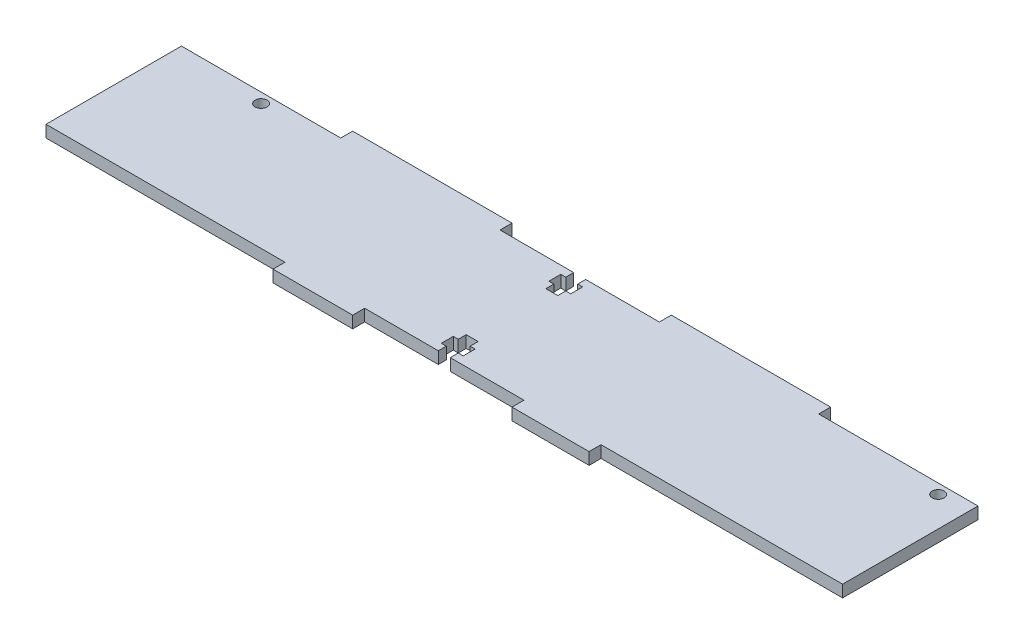
from build123d import *

# Parameters (mm, degrees)
SKETCH1_W           = 200
SKETCH1_H           = 40
BOSS_EXTRUDE1_DEPTH = 3
SKETCH3_W           = 60
SKETCH3_H           = 3
SKETCH3_W_2         = 60.649381746
CUT_EXTRUDE1_DEPTH  = 3
SKETCH4_R           = 1.5
CUT_EXTRUDE2_DEPTH  = 3


with BuildPart() as part:
    # Sketch1 → Boss-Extrude1 (new body)
    with BuildSketch(Plane(origin=(0, 0, 0), x_dir=(1, 0, 0), z_dir=(0, 1, 0))):
        Rectangle(SKETCH1_W, SKETCH1_H)
    extrude(amount=BOSS_EXTRUDE1_DEPTH)

    # Sketch3 → Cut-Extrude1 (cut)
    with BuildSketch(Plane(origin=(0, 3, 0), x_dir=(1, 0, 0), z_dir=(0, 1, 0))):
        Polygon((-20, -20), (-20, -17), (-1.5, -17), (-1.5, -15), (-2.75, -15), (-2.75, -12), (-1.5, -12), (-1.5, -10), (1.5, -10), (1.5, -12), (2.75, -12), (2.75, -15), (1.5, -15), (1.5, -17), (20, -17), (20, -20), align=None)
        with Locations((-70, -18.5)):
            Rectangle(SKETCH3_W, SKETCH3_H)
        with Locations((69.675309127, -18.5)):
            Rectangle(SKETCH3_W_2, SKETCH3_H)
        Polygon((85, 17), (100, 17), (100, 20), (60, 20), (60, 17), (82, 17), align=None)
        Polygon((20, 20), (20, 17), (1.5, 17), (1.5, 15), (2.75, 15), (2.75, 12), (1.5, 12), (1.5, 10), (-1.5, 10), (-1.5, 12), (-2.75, 12), (-2.75, 15), (-1.5, 15), (-1.5, 17), (-20, 17), (-20, 20), align=None)
        Polygon((-60, 20), (-60, 17), (-82, 17), (-85, 17), (-100, 17), (-100, 20), align=None)
    extrude(amount=-CUT_EXTRUDE1_DEPTH, mode=Mode.SUBTRACT)

    # Sketch4 → Cut-Extrude2 (cut)
    with BuildSketch(Plane(origin=(0, 3, 0), x_dir=(1, 0, 0), z_dir=(0, 1, 0))):
        with Locations(Location((92.5, 14.5, 0), (0, 0, 270))):
            Circle(SKETCH4_R)
        with Locations(Location((-77.5, 14.5, 0), (0, 0, 270))):
            Circle(SKETCH4_R)
    extrude(amount=-CUT_EXTRUDE2_DEPTH, mode=Mode.SUBTRACT)


solid = part.part
